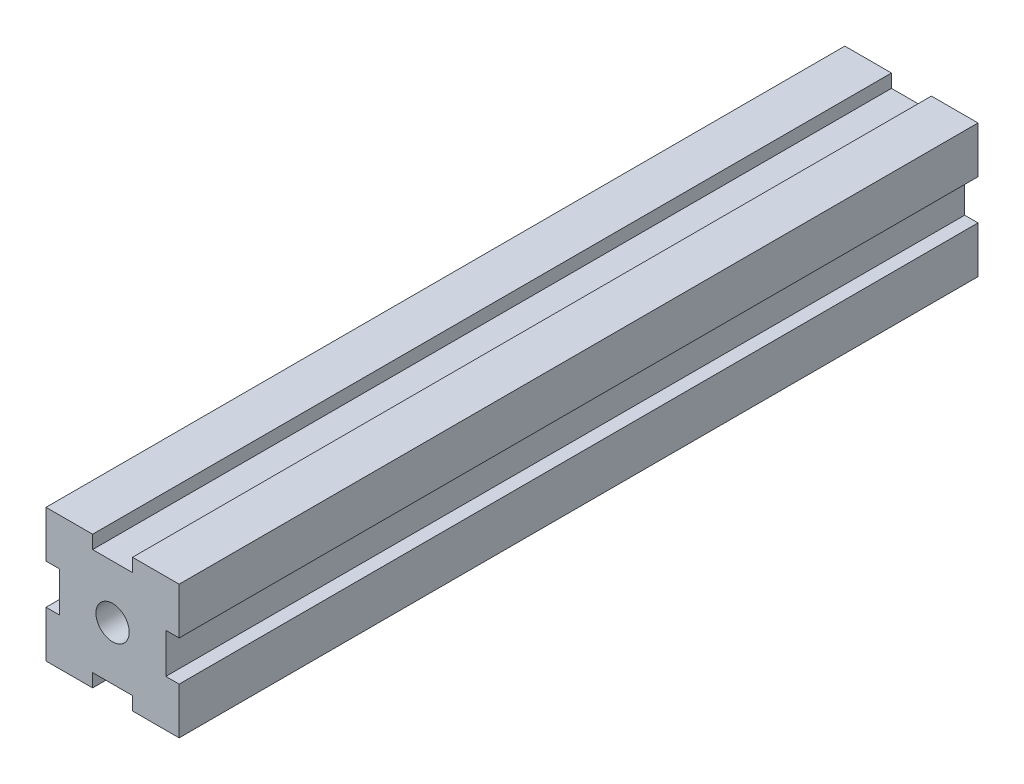
from build123d import *

# Parameters (mm, degrees)
SKETCH_1_R      = 2.5
EXTRUDE_1_DEPTH = 120


with BuildPart() as part:
    # 草图1 → 凸台-拉伸1 (new body)
    with BuildSketch(Plane.XY):
        Polygon((0, -13), (0, -20), (7, -20), (7, -18), (13, -18), (13, -20), (20, -20), (20, -13), (18, -13), (18, -7), (20, -7), (20, 0), (13, 0), (13, -2), (7, -2), (7, 0), (0, 0), (0, -7), (2, -7), (2, -13), align=None)
        with Locations((10, -10)):
            Circle(SKETCH_1_R, mode=Mode.SUBTRACT)
    extrude(amount=EXTRUDE_1_DEPTH)


solid = part.part
